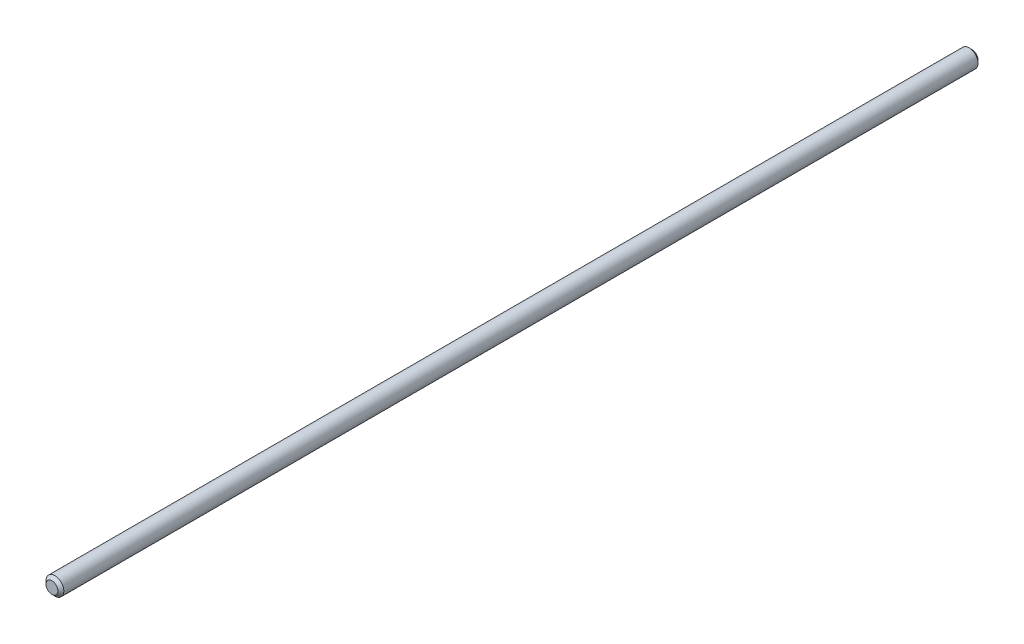
from build123d import *

# Parameters (mm, degrees)
SKETCH1_R           = 3
BOSS_EXTRUDE1_DEPTH = 310
CHAMFER1_SIZE       = 1


with BuildPart() as part:
    # Sketch1 → Boss-Extrude1 (new body)
    with BuildSketch(Plane.XY):
        Circle(SKETCH1_R)
    extrude(amount=BOSS_EXTRUDE1_DEPTH)

    # Chamfer1
    chamfer1_edges = [part.edges().sort_by_distance(p)[0] for p in [
        (-3, 0, 0),
        (-3, 0, 310),
    ]]
    chamfer(chamfer1_edges, length=CHAMFER1_SIZE)


solid = part.part
